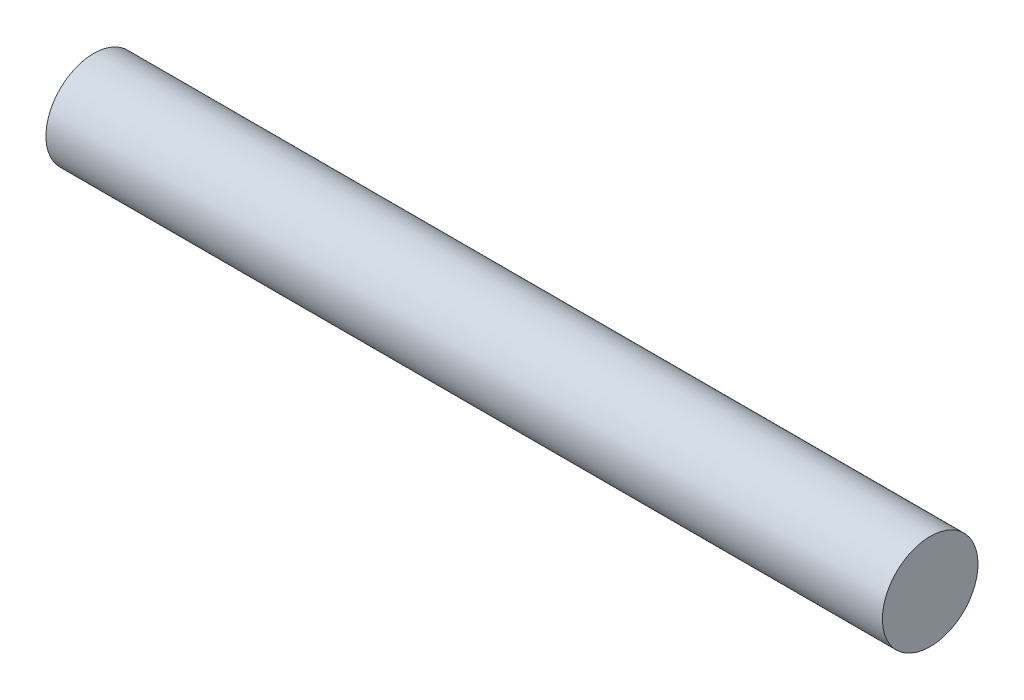
from build123d import *

# Parameters (mm, degrees)
SKETCH1_R           = 4
BOSS_EXTRUDE1_DEPTH = 70


with BuildPart() as part:
    # Sketch1 → Boss-Extrude1 (new body)
    with BuildSketch(Plane(origin=(0, 0, 0), x_dir=(0, 0, -1), z_dir=(1, 0, 0))):
        Circle(SKETCH1_R)
    extrude(amount=BOSS_EXTRUDE1_DEPTH)


solid = part.part
